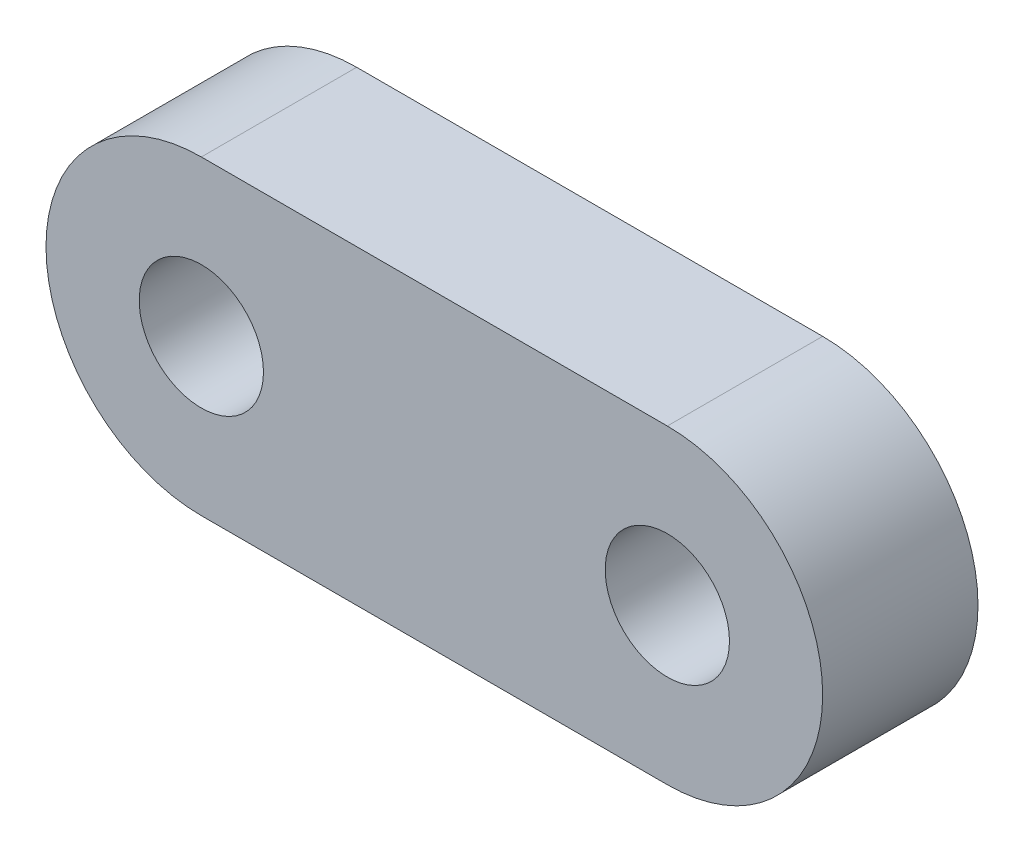
from build123d import *

# Parameters (mm, degrees)
SKETCH_2_R      = 2
EXTRUDE_1_DEPTH = 2.5


with BuildPart() as part:
    # 草圖2 → 填料-伸長1 (new, symmetric)
    with BuildSketch(Plane.XY):
        with BuildLine():
            Line((-7.5, 5), (7.5, 5))
            ThreePointArc((7.5, 5), (12.5, 0), (7.5, -5))
            Line((7.5, -5), (-7.5, -5))
            ThreePointArc((-7.5, -5), (-12.5, 0), (-7.5, 5))
        make_face()
        with Locations((7.5, 0)):
            Circle(SKETCH_2_R, mode=Mode.SUBTRACT)
        with Locations((-7.5, 0)):
            Circle(SKETCH_2_R, mode=Mode.SUBTRACT)
    extrude(amount=EXTRUDE_1_DEPTH, both=True)


solid = part.part
